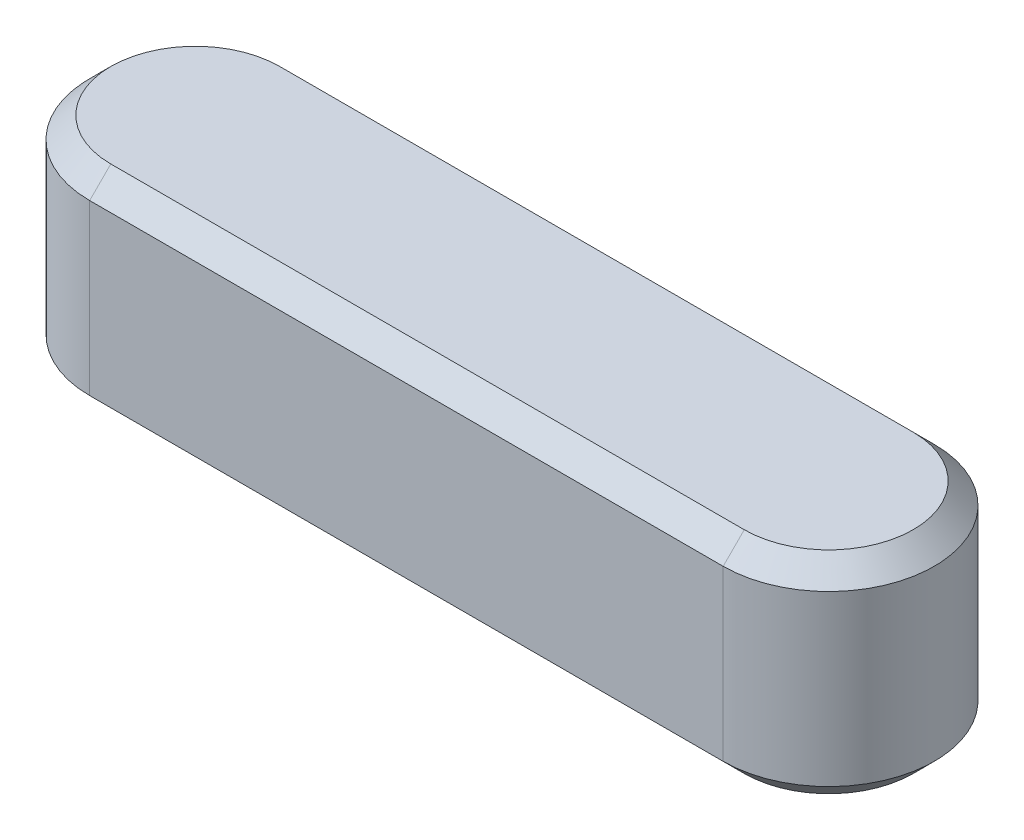
from build123d import *

# Parameters (mm, degrees)
BOSS_EXTRUDE1_DEPTH = 2
CHAMFER1_SIZE       = 0.2


with BuildPart() as part:
    # Sketch1 → Boss-Extrude1 (new body)
    with BuildSketch(Plane(origin=(0, 0, 0), x_dir=(1, 0, 0), z_dir=(0, 1, 0))):
        with BuildLine():
            Line((0, 1), (6, 1))
            ThreePointArc((6, 1), (7, 0), (6, -1))
            Line((6, -1), (0, -1))
            ThreePointArc((0, -1), (-1, 0), (0, 1))
        make_face()
    extrude(amount=BOSS_EXTRUDE1_DEPTH)

    # Chamfer1
    chamfer1_edges = [part.edges().sort_by_distance(p)[0] for p in [
        (7, 2, 0),
        (3, 2, -1),
        (-1, 2, 0),
        (3, 0, -1),
        (7, 0, 0),
        (3, 0, 1),
        (-1, 0, 0),
        (3, 2, 1),
    ]]
    chamfer(chamfer1_edges, length=CHAMFER1_SIZE)


solid = part.part
